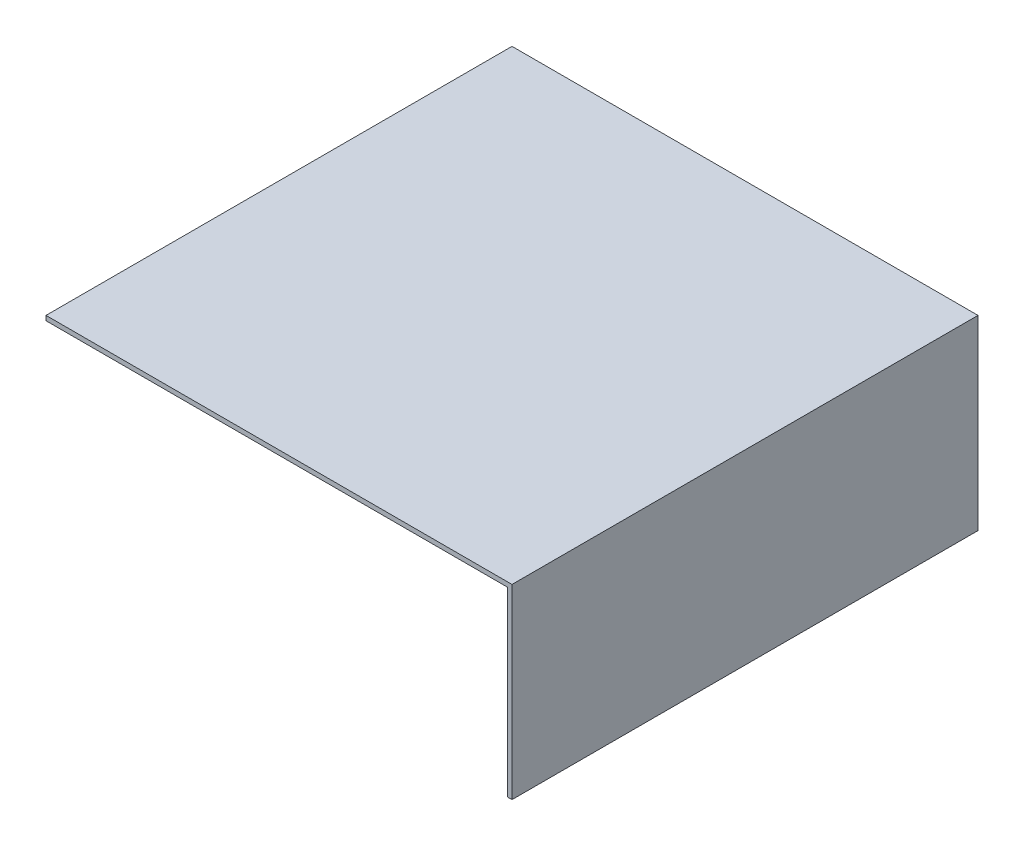
from build123d import *

# Parameters (mm, degrees)
BOSS_EXTRUDE1_DEPTH = 250


with BuildPart() as part:
    # Sketch1 → Boss-Extrude1 (new, symmetric)
    with BuildSketch(Plane.XY):
        Polygon((-500, 0), (0, 0), (0, -200), (-5, -200), (-5, -5), (-500, -5), align=None)
    extrude(amount=BOSS_EXTRUDE1_DEPTH, both=True)


solid = part.part
